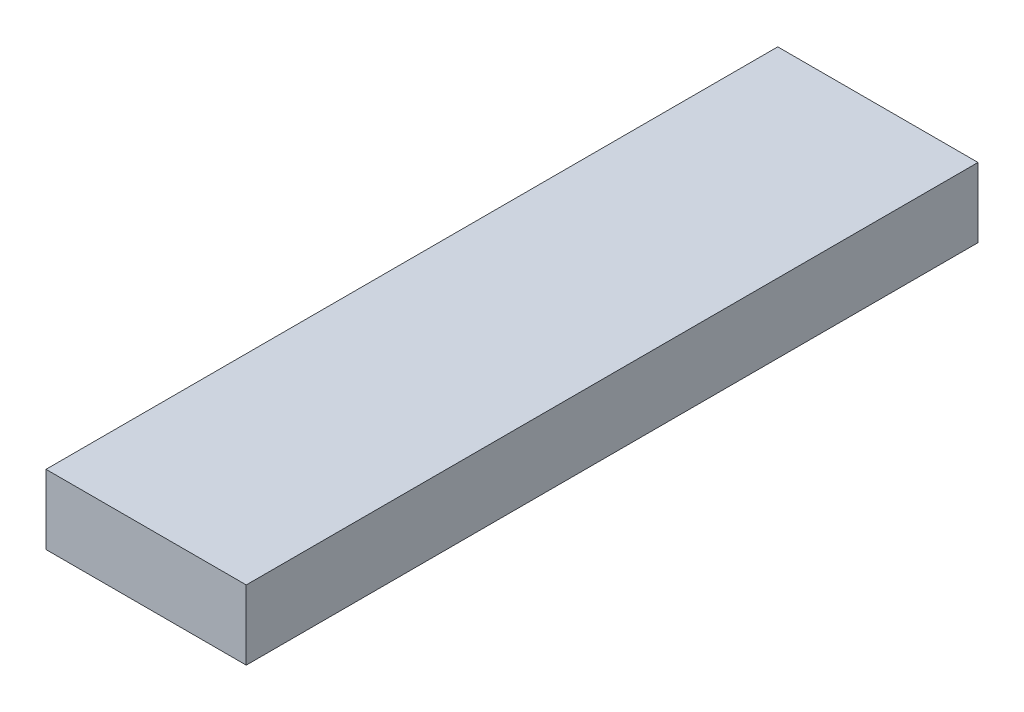
from build123d import *

# Parameters (mm, degrees)
SKETCH1_W           = 54.89448
SKETCH1_H           = 19.05
BOSS_EXTRUDE1_DEPTH = 200.59904


with BuildPart() as part:
    # Sketch1 → Boss-Extrude1 (new body)
    with BuildSketch(Plane.XY):
        Rectangle(SKETCH1_W, SKETCH1_H)
    extrude(amount=BOSS_EXTRUDE1_DEPTH)


solid = part.part
